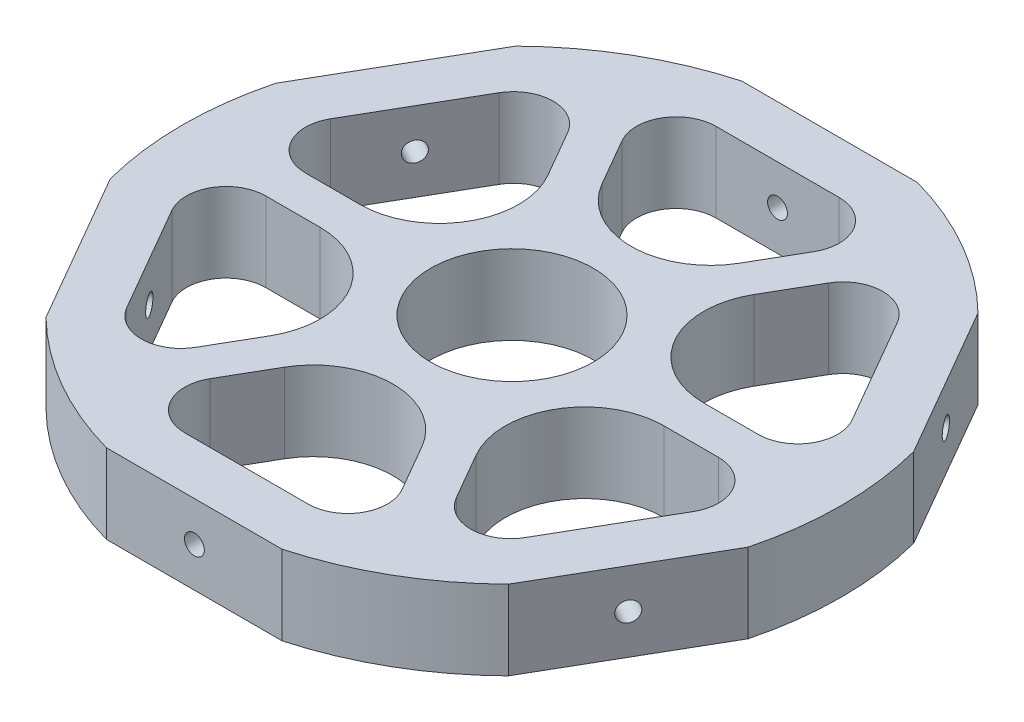
from build123d import *

# Parameters (mm, degrees)
SKETCH2_R           = 20.5
BOSS_EXTRUDE1_DEPTH = 20
SKETCH3_R           = 2.5
CUT_EXTRUDE1_DEPTH  = 20
CIRPATTERN1_COUNT   = 6


with BuildPart() as part:
    # Sketch2 → Boss-Extrude1 (new body)
    with BuildSketch(Plane(origin=(0, 0, 0), x_dir=(1, 0, 0), z_dir=(0, 1, 0))):
        with BuildLine():
            Line((22.113344387, 80), (-22.113344387, 80))
            ThreePointArc((-22.113344387, 80), (-41.5, 71.880108514), (-58.225360109, 59.150718002))
            Line((-58.225360109, 59.150718002), (-80.338704497, 20.849281998))
            ThreePointArc((-80.338704497, 20.849281998), (-83, 0), (-80.338704497, -20.849281998))
            Line((-80.338704497, -20.849281998), (-58.225360109, -59.150718002))
            ThreePointArc((-58.225360109, -59.150718002), (-41.5, -71.880108514), (-22.113344387, -80))
            Line((-22.113344387, -80), (22.113344387, -80))
            ThreePointArc((22.113344387, -80), (41.5, -71.880108514), (58.225360109, -59.150718002))
            Line((58.225360109, -59.150718002), (80.338704497, -20.849281998))
            ThreePointArc((80.338704497, -20.849281998), (83, 0), (80.338704497, 20.849281998))
            Line((80.338704497, 20.849281998), (58.225360109, 59.150718002))
            ThreePointArc((58.225360109, 59.150718002), (41.5, 71.880108514), (22.113344387, 80))
        make_face()
        with Locations(Location((0, 0, 0), (0, 0, 270))):
            Circle(SKETCH2_R, mode=Mode.SUBTRACT)
        with BuildLine():
            Line((-15.519237886, 66.880108514), (15.519237886, 66.880108514))
            ThreePointArc((15.519237886, 66.880108514), (24.179491924, 61.880108514), (24.179491924, 51.880108514))
            Line((24.179491924, 51.880108514), (17.320508076, 40))
            ThreePointArc((17.320508076, 40), (0, 30), (-17.320508076, 40))
            Line((-17.320508076, 40), (-24.179491924, 51.880108514))
            ThreePointArc((-24.179491924, 51.880108514), (-24.179491924, 61.880108514), (-15.519237886, 66.880108514))
        make_face(mode=Mode.SUBTRACT)
        with BuildLine():
            Line((50.160254038, 46.880108514), (65.679491924, 20))
            ThreePointArc((65.679491924, 20), (65.679491924, 10), (57.019237886, 5))
            Line((57.019237886, 5), (43.301270189, 5))
            ThreePointArc((43.301270189, 5), (25.980762114, 15), (25.980762114, 35))
            Line((25.980762114, 35), (32.839745962, 46.880108514))
            ThreePointArc((32.839745962, 46.880108514), (41.5, 51.880108514), (50.160254038, 46.880108514))
        make_face(mode=Mode.SUBTRACT)
        with BuildLine():
            Line((65.679491924, -20), (50.160254038, -46.880108514))
            ThreePointArc((50.160254038, -46.880108514), (41.5, -51.880108514), (32.839745962, -46.880108514))
            Line((32.839745962, -46.880108514), (25.980762114, -35))
            ThreePointArc((25.980762114, -35), (25.980762114, -15), (43.301270189, -5))
            Line((43.301270189, -5), (57.019237886, -5))
            ThreePointArc((57.019237886, -5), (65.679491924, -10), (65.679491924, -20))
        make_face(mode=Mode.SUBTRACT)
        with BuildLine():
            Line((15.519237886, -66.880108514), (-15.519237886, -66.880108514))
            ThreePointArc((-15.519237886, -66.880108514), (-24.179491924, -61.880108514), (-24.179491924, -51.880108514))
            Line((-24.179491924, -51.880108514), (-17.320508076, -40))
            ThreePointArc((-17.320508076, -40), (0, -30), (17.320508076, -40))
            Line((17.320508076, -40), (24.179491924, -51.880108514))
            ThreePointArc((24.179491924, -51.880108514), (24.179491924, -61.880108514), (15.519237886, -66.880108514))
        make_face(mode=Mode.SUBTRACT)
        with BuildLine():
            Line((-50.160254038, -46.880108514), (-65.679491924, -20))
            ThreePointArc((-65.679491924, -20), (-65.679491924, -10), (-57.019237886, -5))
            Line((-57.019237886, -5), (-43.301270189, -5))
            ThreePointArc((-43.301270189, -5), (-25.980762114, -15), (-25.980762114, -35))
            Line((-25.980762114, -35), (-32.839745962, -46.880108514))
            ThreePointArc((-32.839745962, -46.880108514), (-41.5, -51.880108514), (-50.160254038, -46.880108514))
        make_face(mode=Mode.SUBTRACT)
        with BuildLine():
            Line((-65.679491924, 20), (-50.160254038, 46.880108514))
            ThreePointArc((-50.160254038, 46.880108514), (-41.5, 51.880108514), (-32.839745962, 46.880108514))
            Line((-32.839745962, 46.880108514), (-25.980762114, 35))
            ThreePointArc((-25.980762114, 35), (-25.980762114, 15), (-43.301270189, 5))
            Line((-43.301270189, 5), (-57.019237886, 5))
            ThreePointArc((-57.019237886, 5), (-65.679491924, 10), (-65.679491924, 20))
        make_face(mode=Mode.SUBTRACT)
    extrude(amount=BOSS_EXTRUDE1_DEPTH)

    # Sketch3 → Cut-Extrude1 (cut)
    with BuildSketch(Plane.XY.offset(80)):
        with Locations((0, 10)):
            Circle(SKETCH3_R)
    cut_extrude1 = extrude(amount=-CUT_EXTRUDE1_DEPTH, mode=Mode.SUBTRACT)

    # CirPattern1: Cut-Extrude1 ×6 about axis
    cirpattern1_axis = Axis((0, 20, 0), (0, 1, 0))
    for i in range(1, CIRPATTERN1_COUNT):
        add(cut_extrude1.rotate(cirpattern1_axis, i * 360 / CIRPATTERN1_COUNT), mode=Mode.SUBTRACT)


solid = part.part
